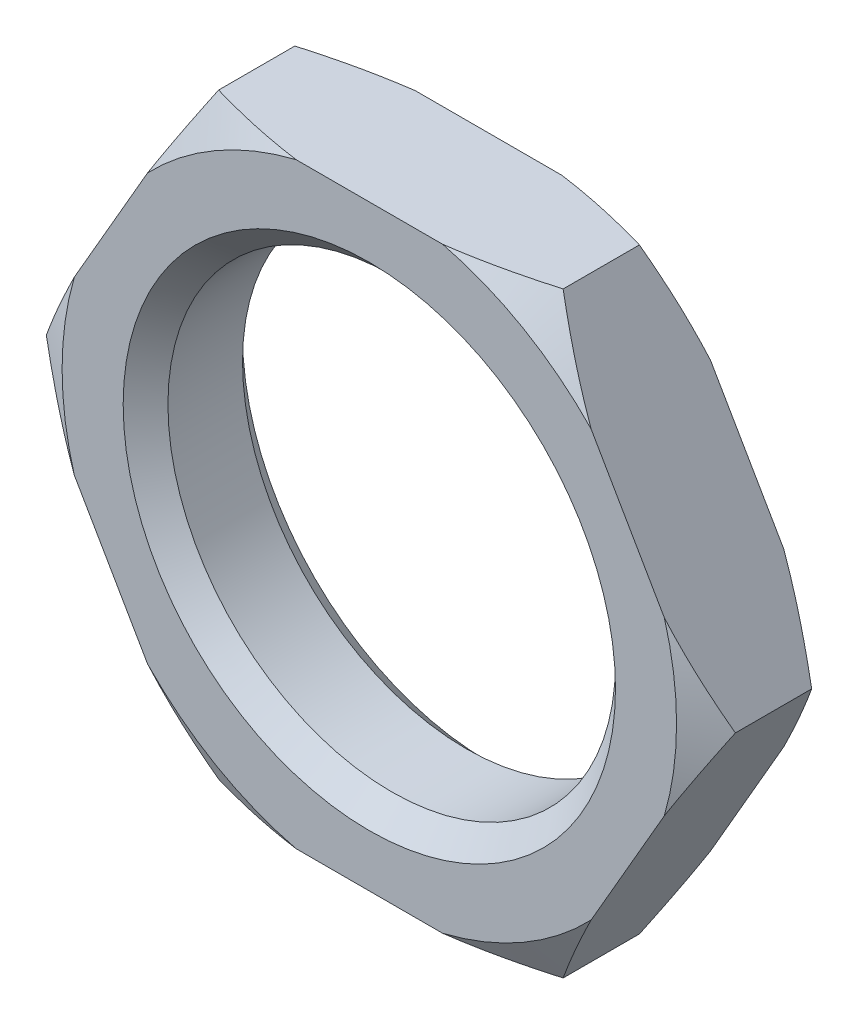
from build123d import *

# Parameters (mm, degrees)
ESQUISSE1_R        = 3
BOSS_EXTRU_1_DEPTH = 1.6
CHANFREIN1_SIZE    = 0.3


with BuildPart() as part:
    # Esquisse1 → Boss.-Extru.1 (new body)
    with BuildSketch(Plane.XY):
        Polygon((4.618802154, 0), (2.309401077, 4), (-2.309401077, 4), (-4.618802154, 0), (-2.309401077, -4), (2.309401077, -4), align=None)
        Circle(ESQUISSE1_R, mode=Mode.SUBTRACT)
    extrude(amount=BOSS_EXTRU_1_DEPTH)

    # Esquisse2 → Enlèvement de matière-Révolution1 (revolve, cut)
    with BuildSketch(Plane(origin=(0, 0, 0), x_dir=(1, 0, 0), z_dir=(0, 1, 0))):
        Polygon((-4.118802154, 0), (-4.618802154, -0.288675135), (-4.618802154, -1.311324865), (-4.118802154, -1.6), (-5.618802154, -1.6), (-5.618802154, 0), align=None)
    revolve(axis=Axis((0, 0, 0), (0, 0, 1)), mode=Mode.SUBTRACT)

    # Chanfrein1
    chanfrein1_edges = [part.edges().sort_by_distance(p)[0] for p in [
        (-3, 0, 0),
        (-3, 0, 1.6),
    ]]
    chamfer(chanfrein1_edges, length=CHANFREIN1_SIZE)


solid = part.part
